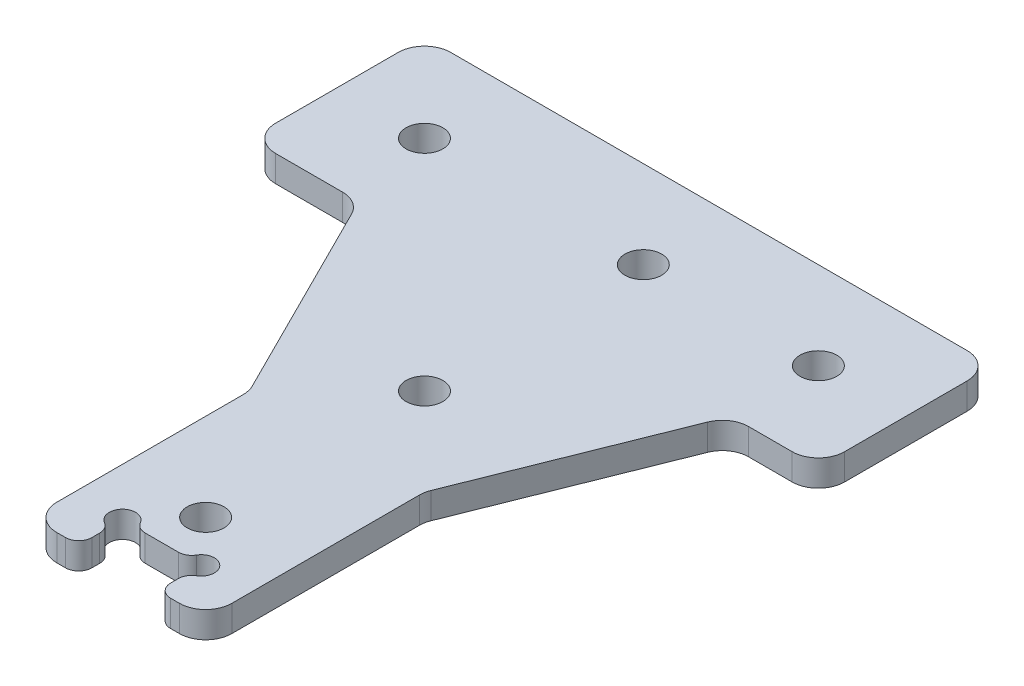
from build123d import *

# Parameters (mm, degrees)
SKETCH_1_R          = 2.1
EXTRUDE_1_DEPTH     = 3
FILLET_1_R          = 3
SKETCH_2_W          = 9
SKETCH_2_H          = 5
CUT_EXTRUDE_1_DEPTH = 3
SKETCH_3_R          = 1.5
CUT_EXTRUDE_2_DEPTH = 10
FILLET_2_R          = 1.5


with BuildPart() as part:
    # 草图1 → 凸台-拉伸1 (new body)
    # profile 1 of 3: a face of its own
    with BuildSketch(Plane(origin=(0, 0, 0), x_dir=(1, 0, 0), z_dir=(0, 1, 0))):
        Polygon((10, -10), (30, -10), (30, 10), (-35, 10), (-35, -10), (-10, -10), (-10, -60), (10, -60), align=None)
        with Locations(Location((0, -50, 0), (0, 0, 270))):
            Circle(SKETCH_1_R, mode=Mode.SUBTRACT)
        with Locations(Location((0, -25, 0), (0, 0, 270))):
            Circle(SKETCH_1_R, mode=Mode.SUBTRACT)
        with Locations(Location((-25, 0, 0), (0, 0, 270))):
            Circle(SKETCH_1_R, mode=Mode.SUBTRACT)
        with Locations(Location((20, 0, 0), (0, 0, 270))):
            Circle(SKETCH_1_R, mode=Mode.SUBTRACT)
        with Locations(Location((0, 0, 0), (0, 0, 270))):
            Circle(SKETCH_1_R, mode=Mode.SUBTRACT)
    # profile 2 of 3: a face of its own
    with BuildSketch(Plane(origin=(0, 0, 0), x_dir=(1, 0, 0), z_dir=(0, 1, 0))):
        Polygon((-10, -10), (-22.5, -10), (-10, -35), align=None)
    # profile 3 of 3: a face of its own
    with BuildSketch(Plane(origin=(0, 0, 0), x_dir=(1, 0, 0), z_dir=(0, 1, 0))):
        Polygon((10, -35), (20, -10), (10, -10), align=None)
    extrude(amount=EXTRUDE_1_DEPTH)

    # 圆角1
    fillet_1_edges = [part.edges().sort_by_distance(p)[0] for p in [
        (10, 1.5, 35),
        (10, 1.5, 60),
        (-10, 1.5, 60),
        (-10, 1.5, 35),
        (-22.5, 1.5, 10),
        (-35, 1.5, 10),
        (-35, 1.5, -10),
        (30, 1.5, -10),
        (30, 1.5, 10),
        (20, 1.5, 10),
    ]]
    fillet(fillet_1_edges, radius=FILLET_1_R)

    # 草图2 → 切除-拉伸1 (cut)
    with BuildSketch(Plane(origin=(0, 3, 0), x_dir=(1, 0, 0), z_dir=(0, 1, 0))):
        with Locations((0, -57.5)):
            Rectangle(SKETCH_2_W, SKETCH_2_H)
    extrude(amount=-CUT_EXTRUDE_1_DEPTH, mode=Mode.SUBTRACT)

    # 草图3 → 切除-拉伸2 (cut)
    with BuildSketch(Plane(origin=(0, 3, 0), x_dir=(1, 0, 0), z_dir=(0, 1, 0))):
        with Locations((-4.5, -55)):
            Circle(SKETCH_3_R)
        with Locations((4.5, -55)):
            Circle(SKETCH_3_R)
    extrude(amount=-CUT_EXTRUDE_2_DEPTH, mode=Mode.SUBTRACT)

    # 圆角2
    fillet_2_edges = [part.edges().sort_by_distance(p)[0] for p in [
        (-4.5, 1.5, 60),
        (4.5, 1.5, 60),
        (4.5, 1.5, 56.5),
        (-3, 1.5, 55),
        (-4.5, 1.5, 56.5),
        (3, 1.5, 55),
    ]]
    fillet(fillet_2_edges, radius=FILLET_2_R)


solid = part.part
